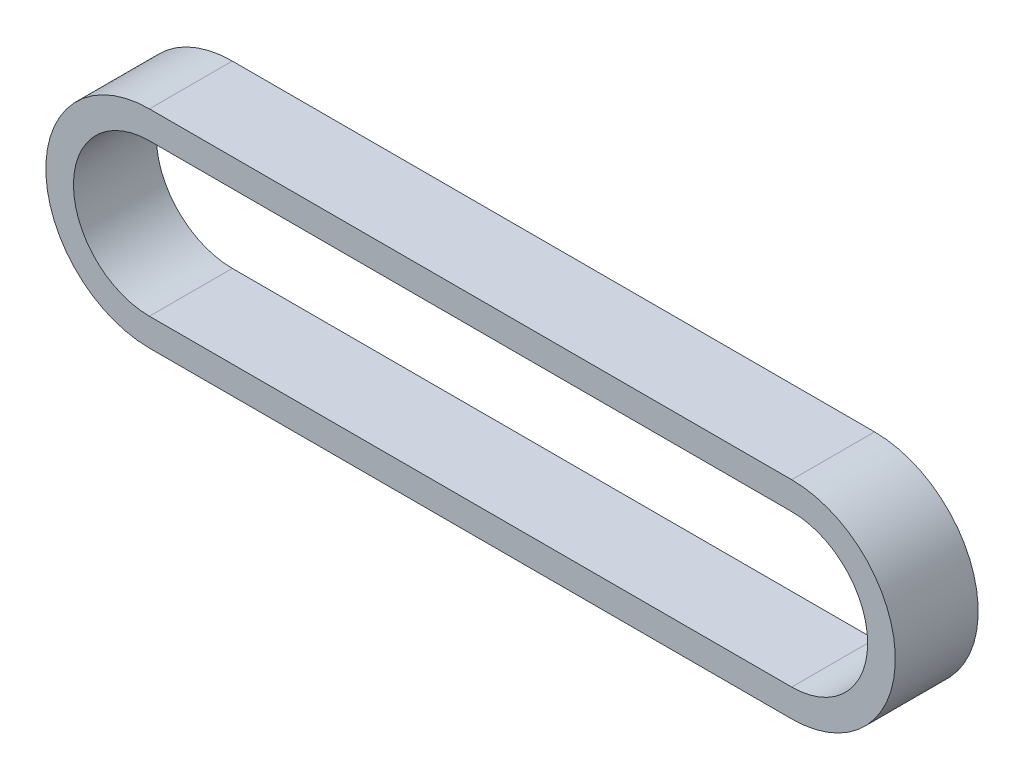
from build123d import *

# Parameters (mm, degrees)
EXTRUDE_1_DEPTH = 6


with BuildPart() as part:
    # 草图1 → 凸台-拉伸1 (new body)
    with BuildSketch(Plane.XY):
        with BuildLine():
            Line((0, 7.5), (46.5, 7.5))
            ThreePointArc((46.5, 7.5), (54, 0), (46.5, -7.5))
            Line((46.5, -7.5), (0, -7.5))
            ThreePointArc((0, -7.5), (-7.5, 0), (0, 7.5))
        make_face()
        with BuildLine():
            Line((0, 5.5), (46.5, 5.5))
            ThreePointArc((46.5, 5.5), (52, 0), (46.5, -5.5))
            Line((46.5, -5.5), (0, -5.5))
            ThreePointArc((0, -5.5), (-5.5, 0), (0, 5.5))
        make_face(mode=Mode.SUBTRACT)
    extrude(amount=EXTRUDE_1_DEPTH)


solid = part.part
